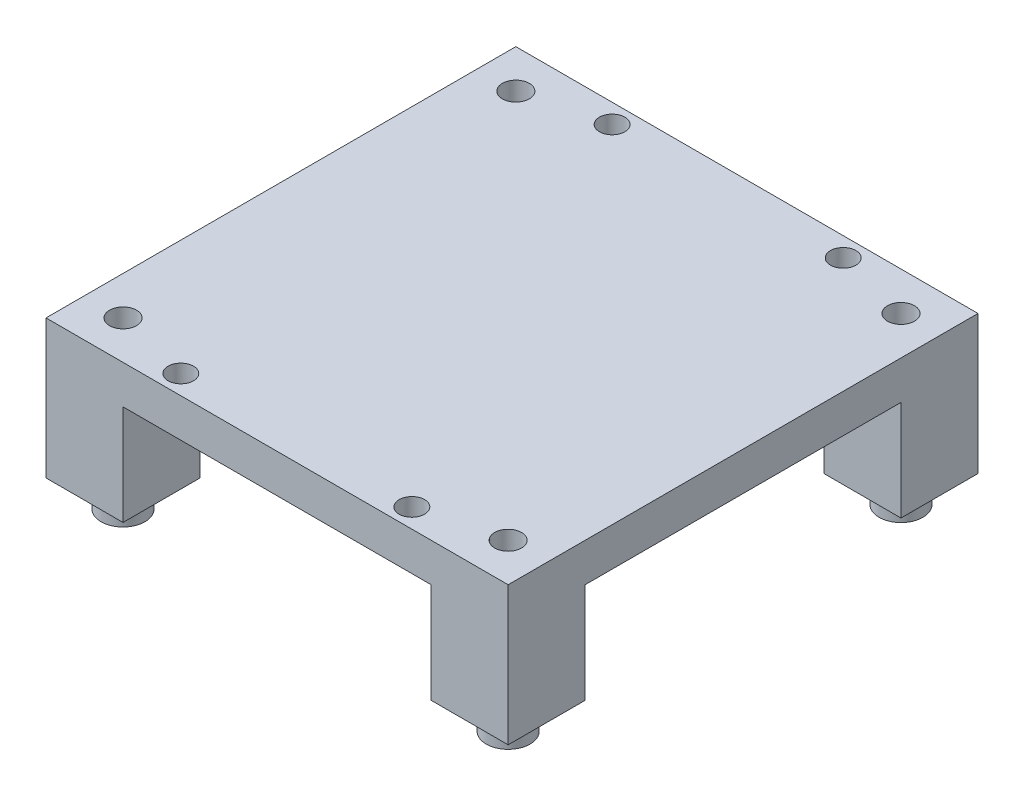
from build123d import *

# Parameters (mm, degrees)
SKETCH_1_W               = 60
SKETCH_1_H               = 61
EXTRUDE_1_DEPTH          = 5
SKETCH_2_W               = 10
SKETCH_2_H               = 10
EXTRUDE_2_DEPTH          = 13
HOLE_WIZARD_2_D          = 3.3
SKETCH_9_R               = 2.85
EXTRUDE_3_DEPTH          = 3.5
SKETCH_5_W               = 1.75
SKETCH_5_H               = 18
HOLE_WIZARD_1_AT_2_COUNT = 2
HOLE_WIZARD_1_AT_2_PITCH = 51
HOLE_WIZARD_1_AT_3_COUNT = 2
HOLE_WIZARD_1_AT_3_PITCH = 71.421285343
HOLE_WIZARD_1_AT_4_COUNT = 2
HOLE_WIZARD_1_AT_4_PITCH = 50
HOLE_WIZARD_3_D          = 3.5


with BuildPart() as part:
    # 草图1 → 凸台-拉伸1 (new body)
    with BuildSketch(Plane(origin=(0, 0, 0), x_dir=(1, 0, 0), z_dir=(0, 1, 0))):
        with Locations((30, 30.5)):
            Rectangle(SKETCH_1_W, SKETCH_1_H)
    extrude(amount=EXTRUDE_1_DEPTH)

    # 草图2 → 凸台-拉伸2 (add)
    with BuildSketch(Plane.XZ):
        with Locations((5, -5)):
            Rectangle(SKETCH_2_W, SKETCH_2_H)
        with Locations((55, -5)):
            Rectangle(SKETCH_2_W, SKETCH_2_H)
        with Locations((55, -56)):
            Rectangle(SKETCH_2_W, SKETCH_2_H)
        with Locations((5, -56)):
            Rectangle(SKETCH_2_W, SKETCH_2_H)
    extrude(amount=EXTRUDE_2_DEPTH)

    # 孔2 (through all)
    with Locations(Plane(origin=(0, 5, 0), x_dir=(1, 0, 0), z_dir=(0, 1, 0))):
        with Locations((15, 58.5), (45, 58.5), (45, 2.5), (15, 2.5)):
            Hole(HOLE_WIZARD_2_D / 2)

    # 草图9 → 凸台-拉伸3 (add)
    with BuildSketch(Plane.XZ.offset(13)):
        with Locations(Location((5, -56, 0), (0, 0, 90))):
            Circle(SKETCH_9_R)
        with Locations(Location((55, -56, 0), (0, 0, 270))):
            Circle(SKETCH_9_R)
        with Locations(Location((55, -5, 0), (0, 0, 90))):
            Circle(SKETCH_9_R)
        with Locations(Location((5, -5, 0), (0, 0, 270))):
            Circle(SKETCH_9_R)
    extrude(amount=EXTRUDE_3_DEPTH)

    # 草图5 → 孔1 (revolve, cut)
    with BuildSketch(Plane(origin=(5, -13, -5), x_dir=(0, 0, -1), z_dir=(1, 0, 0))):
        with Locations((0.875, 9)):
            Rectangle(SKETCH_5_W, SKETCH_5_H)
    hole_wizard_1 = revolve(axis=Axis((5, 97, -5), (0, -1, 0)), mode=Mode.SUBTRACT)

    # 孔1 at 2: 孔1 ×2
    with Locations(*[(0, 0, -i * HOLE_WIZARD_1_AT_2_PITCH) for i in range(1, HOLE_WIZARD_1_AT_2_COUNT)]):
        add(hole_wizard_1, mode=Mode.SUBTRACT)

    # 孔1 at 3: 孔1 ×2
    with Locations(*[Vector(0.7000714109260575, 0, -0.7140728391445785) * (i * HOLE_WIZARD_1_AT_3_PITCH) for i in range(1, HOLE_WIZARD_1_AT_3_COUNT)]):
        add(hole_wizard_1, mode=Mode.SUBTRACT)

    # 孔1 at 4: 孔1 ×2
    with Locations(*[(i * HOLE_WIZARD_1_AT_4_PITCH, 0, 0) for i in range(1, HOLE_WIZARD_1_AT_4_COUNT)]):
        add(hole_wizard_1, mode=Mode.SUBTRACT)

    # 孔3 (through all)
    with Locations(Plane(origin=(0, -16.5, 0), x_dir=(-1, 0, 0), z_dir=(0, -1, 0))):
        with Locations((-5, 5), (-5, 56), (-55, 56), (-55, 5)):
            Hole(HOLE_WIZARD_3_D / 2)


solid = part.part
